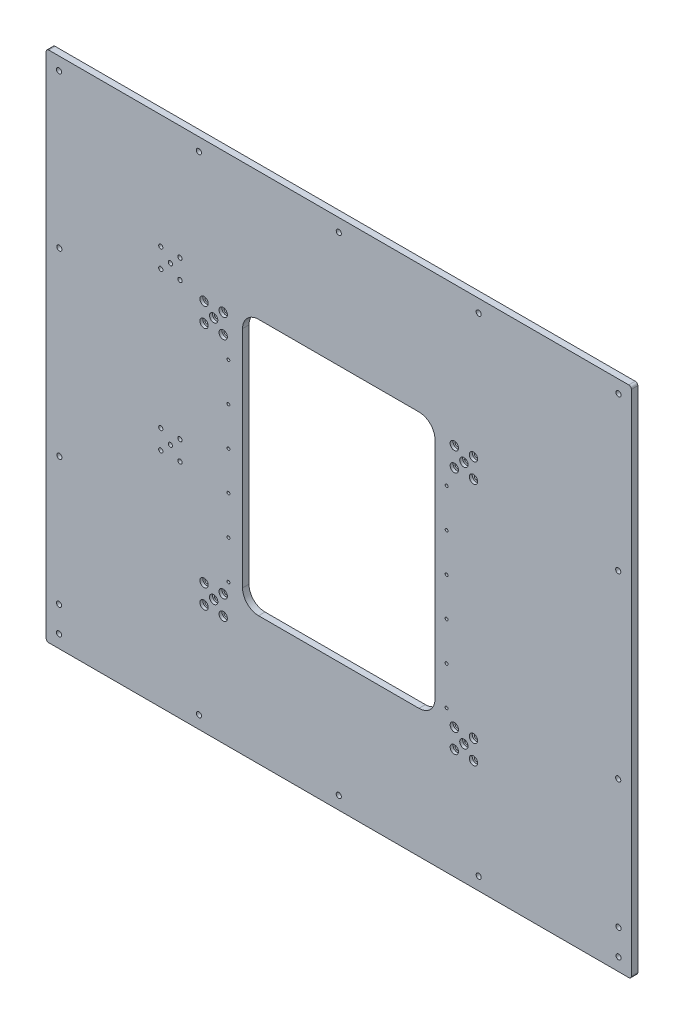
from build123d import *

# Parameters (mm, degrees)
ESQUISSE1_R                                  = 4
BOSS_EXTRU_1_DEPTH                           = 10
ENL_V_MAT_EXTRU_1_DEPTH                      = 607.65970692
D_GAGEMENT_M63_D                             = 6.6
CHAMBRAGE_POUR_VIS_T_TE_RONDE_BOMB_2_COUNT   = 2
CHAMBRAGE_POUR_VIS_T_TE_RONDE_BOMB_2_PITCH   = 29.903233123
CHAMBRAGE_POUR_VIS_T_TE_RONDE_BOMB_3_COUNT   = 2
CHAMBRAGE_POUR_VIS_T_TE_RONDE_BOMB_3_PITCH   = 42.502884267
CHAMBRAGE_POUR_VIS_T_TE_RONDE_BOMB_4_COUNT   = 2
CHAMBRAGE_POUR_VIS_T_TE_RONDE_BOMB_4_PITCH   = 30.204302076
CHAMBRAGE_POUR_VIS_T_TE_RONDE_BOMB_5_COUNT   = 2
CHAMBRAGE_POUR_VIS_T_TE_RONDE_BOMB_5_PITCH   = 21.307827018
R_P_TITION_LIN_AIRE5_COUNT                   = 2
R_P_TITION_LIN_AIRE5_PITCH                   = 245
D_GAGEMENT_M64_D                             = 6.6
CHAMBRAGE_POUR_VIS_T_TE_RONDE_BOMB_6_A_COUNT = 2
CHAMBRAGE_POUR_VIS_T_TE_RONDE_BOMB_6_A_PITCH = 29.866185131
CHAMBRAGE_POUR_VIS_T_TE_RONDE_BOMB_7_COUNT   = 2
CHAMBRAGE_POUR_VIS_T_TE_RONDE_BOMB_7_PITCH   = 29.892115089
CHAMBRAGE_POUR_VIS_T_TE_RONDE_BOMB_8_COUNT   = 2
CHAMBRAGE_POUR_VIS_T_TE_RONDE_BOMB_8_PITCH   = 42.465203215
CHAMBRAGE_POUR_VIS_T_TE_RONDE_BOMB_9_COUNT   = 2
CHAMBRAGE_POUR_VIS_T_TE_RONDE_BOMB_9_PITCH   = 21.205476897
R_P_TITION_LIN_AIRE6_COUNT                   = 2
R_P_TITION_LIN_AIRE6_PITCH                   = 380
R_P_TITION_LIN_AIRE6_COUNT_DIR2              = 2
R_P_TITION_LIN_AIRE6_PITCH_DIR2              = 390
D_GAGEMENT_M41_D                             = 4.5


with BuildPart() as part:
    # Esquisse1 → Boss.-Extru.1 (new body)
    with BuildSketch(Plane.XY):
        with BuildLine():
            Line((-452, -400), (452, -400))
            ThreePointArc((452, -400), (454.828427125, -398.828427125), (456, -396))
            Line((456, -396), (456, 396))
            ThreePointArc((456, 396), (454.828427125, 398.828427125), (452, 400))
            Line((452, 400), (-452, 400))
            ThreePointArc((-452, 400), (-454.828427125, 398.828427125), (-456, 396))
            Line((-456, 396), (-456, -396))
            ThreePointArc((-456, -396), (-454.828427125, -398.828427125), (-452, -400))
        make_face()
        with Locations((436, 380)):
            Circle(ESQUISSE1_R, mode=Mode.SUBTRACT)
        with Locations((435.5, -140)):
            Circle(ESQUISSE1_R, mode=Mode.SUBTRACT)
        with Locations((435.5, 141)):
            Circle(ESQUISSE1_R, mode=Mode.SUBTRACT)
        with Locations(Location((-435.5, -140, 0), (0, 0, 180))):
            Circle(ESQUISSE1_R, mode=Mode.SUBTRACT)
        with Locations(Location((-436, 380, 0), (0, 0, 180))):
            Circle(ESQUISSE1_R, mode=Mode.SUBTRACT)
        with Locations(Location((-435.5, 141, 0), (0, 0, 180))):
            Circle(ESQUISSE1_R, mode=Mode.SUBTRACT)
        with Locations(Location((436, -380, 0), (0, 0, 180))):
            Circle(ESQUISSE1_R, mode=Mode.SUBTRACT)
        with Locations(Location((436, -340, 0), (0, 0, 180))):
            Circle(ESQUISSE1_R, mode=Mode.SUBTRACT)
        with Locations((-436, -340)):
            Circle(ESQUISSE1_R, mode=Mode.SUBTRACT)
        with Locations((-436, -380)):
            Circle(ESQUISSE1_R, mode=Mode.SUBTRACT)
        with Locations(Location((218, -380, 0), (0, 0, 180))):
            Circle(ESQUISSE1_R, mode=Mode.SUBTRACT)
        with Locations(Location((0, -380, 0), (0, 0, 180))):
            Circle(ESQUISSE1_R, mode=Mode.SUBTRACT)
        with Locations(Location((-218, -380, 0), (0, 0, 180))):
            Circle(ESQUISSE1_R, mode=Mode.SUBTRACT)
        with Locations((-218, 380)):
            Circle(ESQUISSE1_R, mode=Mode.SUBTRACT)
        with Locations((0, 380)):
            Circle(ESQUISSE1_R, mode=Mode.SUBTRACT)
        with Locations((218, 380)):
            Circle(ESQUISSE1_R, mode=Mode.SUBTRACT)
    extrude(amount=BOSS_EXTRU_1_DEPTH)

    # Esquisse2 → Enlèv. mat.-Extru.1 (cut, through all)
    with BuildSketch(Plane.XY.offset(10)):
        with BuildLine():
            Line((-125, -200), (125, -200))
            ThreePointArc((125, -200), (142.67766953, -192.67766953), (150, -175))
            Line((150, -175), (150, 175))
            ThreePointArc((150, 175), (142.67766953, 192.67766953), (125, 200))
            Line((125, 200), (-125, 200))
            ThreePointArc((-125, 200), (-142.67766953, 192.67766953), (-150, 175))
            Line((-150, 175), (-150, -175))
            ThreePointArc((-150, -175), (-142.67766953, -192.67766953), (-125, -200))
        make_face()
    extrude(amount=-ENL_V_MAT_EXTRU_1_DEPTH, mode=Mode.SUBTRACT)

    # Dégagement M63 (through all)
    with Locations(Plane.XY.offset(10)):
        with Locations((-247.5, 222.133522135), (-277.40309862, 222.043833056), (-262.5, 207), (-277.40309862, 191.929220059), (-247.5, 191.929220059)):
            Hole(D_GAGEMENT_M63_D / 2)

    # Esquisse17 → Chambrage pour vis _ t_te ronde bomb_e M (revolve, cut)
    with BuildSketch(Plane(origin=(-247.5, 222.133522135, 0), x_dir=(0, 1, 0), z_dir=(1, 0, 0))):
        Polygon((0, 0), (0, 10), (3.3, 10), (3.3, 4.625), (3.325, 4.6), (6.5, 4.6), (6.5, 0), align=None)
    chambrage_pour_vis_t_te_ronde_bomb_e_m = revolve(axis=Axis((-247.5, 222.133522135, -6.35), (0, 0, 1)), mode=Mode.SUBTRACT)

    # Chambrage pour vis _ t_te ronde bomb 2: Chambrage pour vis _ t_te ronde bomb_e M ×2
    with Locations(*[Vector(-0.9999955020583202, -0.0029993104421098286, 0) * (i * CHAMBRAGE_POUR_VIS_T_TE_RONDE_BOMB_2_PITCH) for i in range(1, CHAMBRAGE_POUR_VIS_T_TE_RONDE_BOMB_2_COUNT)]):
        add(chambrage_pour_vis_t_te_ronde_bomb_e_m, mode=Mode.SUBTRACT)

    # Chambrage pour vis _ t_te ronde bomb 3: Chambrage pour vis _ t_te ronde bomb_e M ×2
    with Locations(*[Vector(-0.7035545736691756, -0.7106412328799846, 0) * (i * CHAMBRAGE_POUR_VIS_T_TE_RONDE_BOMB_3_PITCH) for i in range(1, CHAMBRAGE_POUR_VIS_T_TE_RONDE_BOMB_3_COUNT)]):
        add(chambrage_pour_vis_t_te_ronde_bomb_e_m, mode=Mode.SUBTRACT)

    # Chambrage pour vis _ t_te ronde bomb 4: Chambrage pour vis _ t_te ronde bomb_e M ×2
    with Locations(*[(0, -i * CHAMBRAGE_POUR_VIS_T_TE_RONDE_BOMB_4_PITCH, 0) for i in range(1, CHAMBRAGE_POUR_VIS_T_TE_RONDE_BOMB_4_COUNT)]):
        add(chambrage_pour_vis_t_te_ronde_bomb_e_m, mode=Mode.SUBTRACT)

    # Chambrage pour vis _ t_te ronde bomb 5: Chambrage pour vis _ t_te ronde bomb_e M ×2
    with Locations(*[Vector(-0.7039666685624426, -0.7102330107458369, 0) * (i * CHAMBRAGE_POUR_VIS_T_TE_RONDE_BOMB_5_PITCH) for i in range(1, CHAMBRAGE_POUR_VIS_T_TE_RONDE_BOMB_5_COUNT)]):
        add(chambrage_pour_vis_t_te_ronde_bomb_e_m, mode=Mode.SUBTRACT)

    # Répétition linéaire5: Chambrage pour vis _ t_te ronde bomb_e M ×2
    with Locations(*[(0, -i * R_P_TITION_LIN_AIRE5_PITCH, 0) for i in range(1, R_P_TITION_LIN_AIRE5_COUNT)]):
        add(chambrage_pour_vis_t_te_ronde_bomb_e_m, mode=Mode.SUBTRACT)

    # Répétition linéaire5 copy 1 sketch → Répétition linéaire5 copy 1 (revolve, cut)
    with BuildSketch(Plane(origin=(-277.40309862, -22.956166944, 0), x_dir=(0, 1, 0), z_dir=(1, 0, 0))):
        Polygon((0, 0), (0, 10), (3.3, 10), (3.3, 4.625), (3.325, 4.6), (6.5, 4.6), (6.5, 0), align=None)
    revolve(axis=Axis((-277.40309862, -22.956166944, -6.35), (0, 0, 1)), mode=Mode.SUBTRACT)

    # Répétition linéaire5 copy 2 sketch → Répétition linéaire5 copy 2 (revolve, cut)
    with BuildSketch(Plane(origin=(-277.40309862, -53.070779941, 0), x_dir=(0, 1, 0), z_dir=(1, 0, 0))):
        Polygon((0, 0), (0, 10), (3.3, 10), (3.3, 4.625), (3.325, 4.6), (6.5, 4.6), (6.5, 0), align=None)
    revolve(axis=Axis((-277.40309862, -53.070779941, -6.35), (0, 0, 1)), mode=Mode.SUBTRACT)

    # Répétition linéaire5 copy 3 sketch → Répétition linéaire5 copy 3 (revolve, cut)
    with BuildSketch(Plane(origin=(-247.5, -53.070779941, 0), x_dir=(0, 1, 0), z_dir=(1, 0, 0))):
        Polygon((0, 0), (0, 10), (3.3, 10), (3.3, 4.625), (3.325, 4.6), (6.5, 4.6), (6.5, 0), align=None)
    revolve(axis=Axis((-247.5, -53.070779941, -6.35), (0, 0, 1)), mode=Mode.SUBTRACT)

    # Répétition linéaire5 copy 4 sketch → Répétition linéaire5 copy 4 (revolve, cut)
    with BuildSketch(Plane(origin=(-262.5, -38, 0), x_dir=(0, 1, 0), z_dir=(1, 0, 0))):
        Polygon((0, 0), (0, 10), (3.3, 10), (3.3, 4.625), (3.325, 4.6), (6.5, 4.6), (6.5, 0), align=None)
    revolve(axis=Axis((-262.5, -38, -6.35), (0, 0, 1)), mode=Mode.SUBTRACT)

    # Dégagement M64 (through all)
    with Locations(Plane(origin=(0, 0, 0), x_dir=(-1, 0, 0), z_dir=(0, 0, -1))):
        with Locations((195, 167), (209.989071032, 182), (209.989071032, 152.107884911), (180.122885902, 151.812180107), (180.122885902, 182)):
            Hole(D_GAGEMENT_M64_D / 2)

    # Esquisse21 → Chambrage pour vis _ t_te ronde bomb 6 (revolve, cut)
    with BuildSketch(Plane(origin=(-209.989071032, 182, 10), x_dir=(0, -1, 0), z_dir=(1, 0, 0))):
        Polygon((0, 0), (0, 10), (3.3, 10), (3.3, 4.625), (3.325, 4.6), (6.5, 4.6), (6.5, 0), align=None)
    chambrage_pour_vis_t_te_ronde_bomb_6 = revolve(axis=Axis((-209.989071032, 182, 16.35), (0, 0, -1)), mode=Mode.SUBTRACT)

    # Chambrage pour vis _ t_te ronde bomb 6 a: Chambrage pour vis _ t_te ronde bomb 6 ×2
    with Locations(*[(i * CHAMBRAGE_POUR_VIS_T_TE_RONDE_BOMB_6_A_PITCH, 0, 0) for i in range(1, CHAMBRAGE_POUR_VIS_T_TE_RONDE_BOMB_6_A_COUNT)]):
        add(chambrage_pour_vis_t_te_ronde_bomb_6, mode=Mode.SUBTRACT)

    # Chambrage pour vis _ t_te ronde bomb 7: Chambrage pour vis _ t_te ronde bomb 6 ×2
    with Locations(*[(0, -i * CHAMBRAGE_POUR_VIS_T_TE_RONDE_BOMB_7_PITCH, 0) for i in range(1, CHAMBRAGE_POUR_VIS_T_TE_RONDE_BOMB_7_COUNT)]):
        add(chambrage_pour_vis_t_te_ronde_bomb_6, mode=Mode.SUBTRACT)

    # Chambrage pour vis _ t_te ronde bomb 8: Chambrage pour vis _ t_te ronde bomb 6 ×2
    with Locations(*[Vector(0.7033096010204793, -0.7108836790308343, 0) * (i * CHAMBRAGE_POUR_VIS_T_TE_RONDE_BOMB_8_PITCH) for i in range(1, CHAMBRAGE_POUR_VIS_T_TE_RONDE_BOMB_8_COUNT)]):
        add(chambrage_pour_vis_t_te_ronde_bomb_6, mode=Mode.SUBTRACT)

    # Chambrage pour vis _ t_te ronde bomb 9: Chambrage pour vis _ t_te ronde bomb 6 ×2
    with Locations(*[Vector(0.7068490421353867, -0.7073644263265481, 0) * (i * CHAMBRAGE_POUR_VIS_T_TE_RONDE_BOMB_9_PITCH) for i in range(1, CHAMBRAGE_POUR_VIS_T_TE_RONDE_BOMB_9_COUNT)]):
        add(chambrage_pour_vis_t_te_ronde_bomb_6, mode=Mode.SUBTRACT)

    # Répétition linéaire6: Chambrage pour vis _ t_te ronde bomb 6 2 × 2
    with Locations(*[(j * R_P_TITION_LIN_AIRE6_PITCH_DIR2, -i * R_P_TITION_LIN_AIRE6_PITCH, 0) for i in range(R_P_TITION_LIN_AIRE6_COUNT) for j in range(R_P_TITION_LIN_AIRE6_COUNT_DIR2) if (i, j) != (0, 0)]):
        add(chambrage_pour_vis_t_te_ronde_bomb_6, mode=Mode.SUBTRACT)

    # Répétition linéaire6 copy 1 sketch → Répétition linéaire6 copy 1 (revolve, cut)
    with BuildSketch(Plane(origin=(209.877114098, 182, 10), x_dir=(0, -1, 0), z_dir=(1, 0, 0))):
        Polygon((0, 0), (0, 10), (3.3, 10), (3.3, 4.625), (3.325, 4.6), (6.5, 4.6), (6.5, 0), align=None)
    revolve(axis=Axis((209.877114098, 182, 16.35), (0, 0, -1)), mode=Mode.SUBTRACT)

    # Répétition linéaire6 copy 2 sketch → Répétition linéaire6 copy 2 (revolve, cut)
    with BuildSketch(Plane(origin=(-180.122885902, -198, 10), x_dir=(0, -1, 0), z_dir=(1, 0, 0))):
        Polygon((0, 0), (0, 10), (3.3, 10), (3.3, 4.625), (3.325, 4.6), (6.5, 4.6), (6.5, 0), align=None)
    revolve(axis=Axis((-180.122885902, -198, 16.35), (0, 0, -1)), mode=Mode.SUBTRACT)

    # Répétition linéaire6 copy 3 sketch → Répétition linéaire6 copy 3 (revolve, cut)
    with BuildSketch(Plane(origin=(209.877114098, -198, 10), x_dir=(0, -1, 0), z_dir=(1, 0, 0))):
        Polygon((0, 0), (0, 10), (3.3, 10), (3.3, 4.625), (3.325, 4.6), (6.5, 4.6), (6.5, 0), align=None)
    revolve(axis=Axis((209.877114098, -198, 16.35), (0, 0, -1)), mode=Mode.SUBTRACT)

    # Répétition linéaire6 copy 4 sketch → Répétition linéaire6 copy 4 (revolve, cut)
    with BuildSketch(Plane(origin=(180.010928968, 152.107884911, 10), x_dir=(0, -1, 0), z_dir=(1, 0, 0))):
        Polygon((0, 0), (0, 10), (3.3, 10), (3.3, 4.625), (3.325, 4.6), (6.5, 4.6), (6.5, 0), align=None)
    revolve(axis=Axis((180.010928968, 152.107884911, 16.35), (0, 0, -1)), mode=Mode.SUBTRACT)

    # Répétition linéaire6 copy 5 sketch → Répétition linéaire6 copy 5 (revolve, cut)
    with BuildSketch(Plane(origin=(-209.989071032, -227.892115089, 10), x_dir=(0, -1, 0), z_dir=(1, 0, 0))):
        Polygon((0, 0), (0, 10), (3.3, 10), (3.3, 4.625), (3.325, 4.6), (6.5, 4.6), (6.5, 0), align=None)
    revolve(axis=Axis((-209.989071032, -227.892115089, 16.35), (0, 0, -1)), mode=Mode.SUBTRACT)

    # Répétition linéaire6 copy 6 sketch → Répétition linéaire6 copy 6 (revolve, cut)
    with BuildSketch(Plane(origin=(180.010928968, -227.892115089, 10), x_dir=(0, -1, 0), z_dir=(1, 0, 0))):
        Polygon((0, 0), (0, 10), (3.3, 10), (3.3, 4.625), (3.325, 4.6), (6.5, 4.6), (6.5, 0), align=None)
    revolve(axis=Axis((180.010928968, -227.892115089, 16.35), (0, 0, -1)), mode=Mode.SUBTRACT)

    # Répétition linéaire6 copy 7 sketch → Répétition linéaire6 copy 7 (revolve, cut)
    with BuildSketch(Plane(origin=(209.877114098, 151.812180107, 10), x_dir=(0, -1, 0), z_dir=(1, 0, 0))):
        Polygon((0, 0), (0, 10), (3.3, 10), (3.3, 4.625), (3.325, 4.6), (6.5, 4.6), (6.5, 0), align=None)
    revolve(axis=Axis((209.877114098, 151.812180107, 16.35), (0, 0, -1)), mode=Mode.SUBTRACT)

    # Répétition linéaire6 copy 8 sketch → Répétition linéaire6 copy 8 (revolve, cut)
    with BuildSketch(Plane(origin=(-180.122885902, -228.187819893, 10), x_dir=(0, -1, 0), z_dir=(1, 0, 0))):
        Polygon((0, 0), (0, 10), (3.3, 10), (3.3, 4.625), (3.325, 4.6), (6.5, 4.6), (6.5, 0), align=None)
    revolve(axis=Axis((-180.122885902, -228.187819893, 16.35), (0, 0, -1)), mode=Mode.SUBTRACT)

    # Répétition linéaire6 copy 9 sketch → Répétition linéaire6 copy 9 (revolve, cut)
    with BuildSketch(Plane(origin=(209.877114098, -228.187819893, 10), x_dir=(0, -1, 0), z_dir=(1, 0, 0))):
        Polygon((0, 0), (0, 10), (3.3, 10), (3.3, 4.625), (3.325, 4.6), (6.5, 4.6), (6.5, 0), align=None)
    revolve(axis=Axis((209.877114098, -228.187819893, 16.35), (0, 0, -1)), mode=Mode.SUBTRACT)

    # Répétition linéaire6 copy 10 sketch → Répétition linéaire6 copy 10 (revolve, cut)
    with BuildSketch(Plane(origin=(195, 167, 10), x_dir=(0, -1, 0), z_dir=(1, 0, 0))):
        Polygon((0, 0), (0, 10), (3.3, 10), (3.3, 4.625), (3.325, 4.6), (6.5, 4.6), (6.5, 0), align=None)
    revolve(axis=Axis((195, 167, 16.35), (0, 0, -1)), mode=Mode.SUBTRACT)

    # Répétition linéaire6 copy 11 sketch → Répétition linéaire6 copy 11 (revolve, cut)
    with BuildSketch(Plane(origin=(-195, -213, 10), x_dir=(0, -1, 0), z_dir=(1, 0, 0))):
        Polygon((0, 0), (0, 10), (3.3, 10), (3.3, 4.625), (3.325, 4.6), (6.5, 4.6), (6.5, 0), align=None)
    revolve(axis=Axis((-195, -213, 16.35), (0, 0, -1)), mode=Mode.SUBTRACT)

    # Répétition linéaire6 copy 12 sketch → Répétition linéaire6 copy 12 (revolve, cut)
    with BuildSketch(Plane(origin=(195, -213, 10), x_dir=(0, -1, 0), z_dir=(1, 0, 0))):
        Polygon((0, 0), (0, 10), (3.3, 10), (3.3, 4.625), (3.325, 4.6), (6.5, 4.6), (6.5, 0), align=None)
    revolve(axis=Axis((195, -213, 16.35), (0, 0, -1)), mode=Mode.SUBTRACT)

    # Dégagement M41 (through all)
    with Locations(Plane.XY.offset(10)):
        with Locations((-172, 122), (-172, 62), (-172, 2), (-172, -58), (-172, -118), (-172, -178), (168, -178), (168, -118), (168, -58), (168, 2), (168, 62), (168, 122)):
            Hole(D_GAGEMENT_M41_D / 2)


solid = part.part
